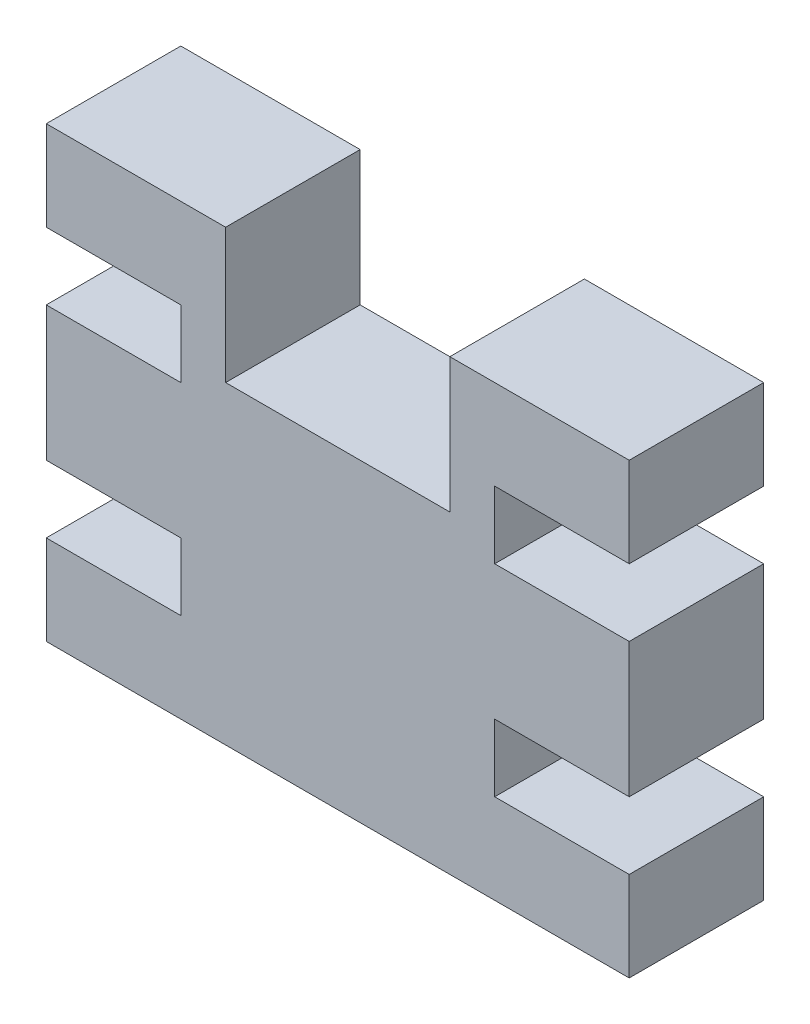
from build123d import *

# Parameters (mm, degrees)
SKETCH1_W           = 13
SKETCH1_H           = 10
BOSS_EXTRUDE1_DEPTH = 3
SKETCH2_W           = 3
SKETCH2_H           = 1.5
CUT_EXTRUDE1_DEPTH  = 3
SKETCH3_W           = 3
SKETCH3_H           = 1.5
CUT_EXTRUDE2_DEPTH  = 3
SKETCH5_W           = 5
SKETCH5_H           = 3
CUT_EXTRUDE6_DEPTH  = 3


with BuildPart() as part:
    # Sketch1 → Boss-Extrude1 (new body)
    with BuildSketch(Plane.XY):
        with Locations((0, 9.633458647)):
            Rectangle(SKETCH1_W, SKETCH1_H)
    extrude(amount=BOSS_EXTRUDE1_DEPTH)

    # Sketch2 → Cut-Extrude1 (cut)
    with BuildSketch(Plane.XY.offset(3)):
        with Locations((-5, 11.883458647)):
            Rectangle(SKETCH2_W, SKETCH2_H)
        with Locations((-5, 7.383458647)):
            Rectangle(SKETCH2_W, SKETCH2_H)
    extrude(amount=-CUT_EXTRUDE1_DEPTH, mode=Mode.SUBTRACT)

    # Sketch3 → Cut-Extrude2 (cut)
    with BuildSketch(Plane.XY.offset(3)):
        with Locations((5, 11.883458647)):
            Rectangle(SKETCH3_W, SKETCH3_H)
        with Locations((5, 7.383458647)):
            Rectangle(SKETCH3_W, SKETCH3_H)
    extrude(amount=-CUT_EXTRUDE2_DEPTH, mode=Mode.SUBTRACT)

    # Sketch5 → Cut-Extrude6 (cut)
    with BuildSketch(Plane.XY.offset(3)):
        with Locations((0, 13.133458647)):
            Rectangle(SKETCH5_W, SKETCH5_H)
    extrude(amount=-CUT_EXTRUDE6_DEPTH, mode=Mode.SUBTRACT)


solid = part.part
